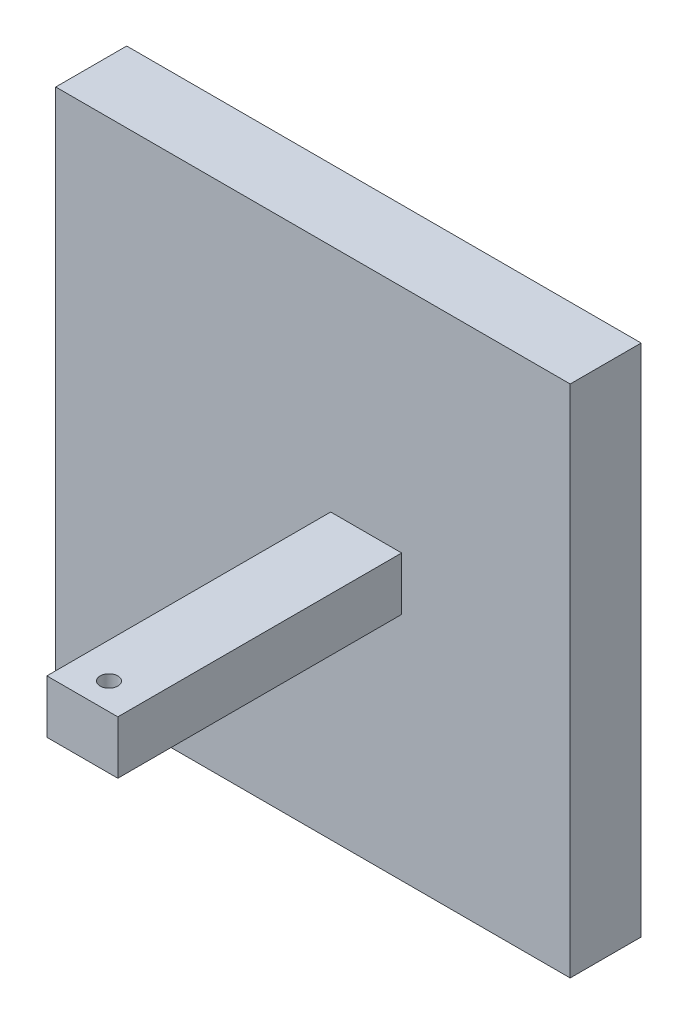
from build123d import *

# Parameters (mm, degrees)
SKETCH1_W           = 736.6
SKETCH1_H           = 736.6
BOSS_EXTRUDE1_DEPTH = 101.6
SKETCH2_W           = 101.6
SKETCH2_H           = 76.2
BOSS_EXTRUDE2_DEPTH = 406.4
SKETCH3_R           = 12.7
CUT_EXTRUDE1_DEPTH  = 508


with BuildPart() as part:
    # Sketch1 → Boss-Extrude1 (new body)
    with BuildSketch(Plane.XY):
        Rectangle(SKETCH1_W, SKETCH1_H)
    extrude(amount=BOSS_EXTRUDE1_DEPTH)

    # Sketch2 → Boss-Extrude2 (add)
    with BuildSketch(Plane.XY.offset(101.6)):
        with Locations((76.2, 0)):
            Rectangle(SKETCH2_W, SKETCH2_H)
    extrude(amount=BOSS_EXTRUDE2_DEPTH)

    # Sketch3 → Cut-Extrude1 (cut)
    with BuildSketch(Plane(origin=(0, -38.1, 0), x_dir=(-1, 0, 0), z_dir=(0, -1, 0))):
        with Locations(Location((-76.2, -469.9, 0), (0, 0, 90))):
            Circle(SKETCH3_R)
    extrude(amount=-CUT_EXTRUDE1_DEPTH, mode=Mode.SUBTRACT)


solid = part.part
